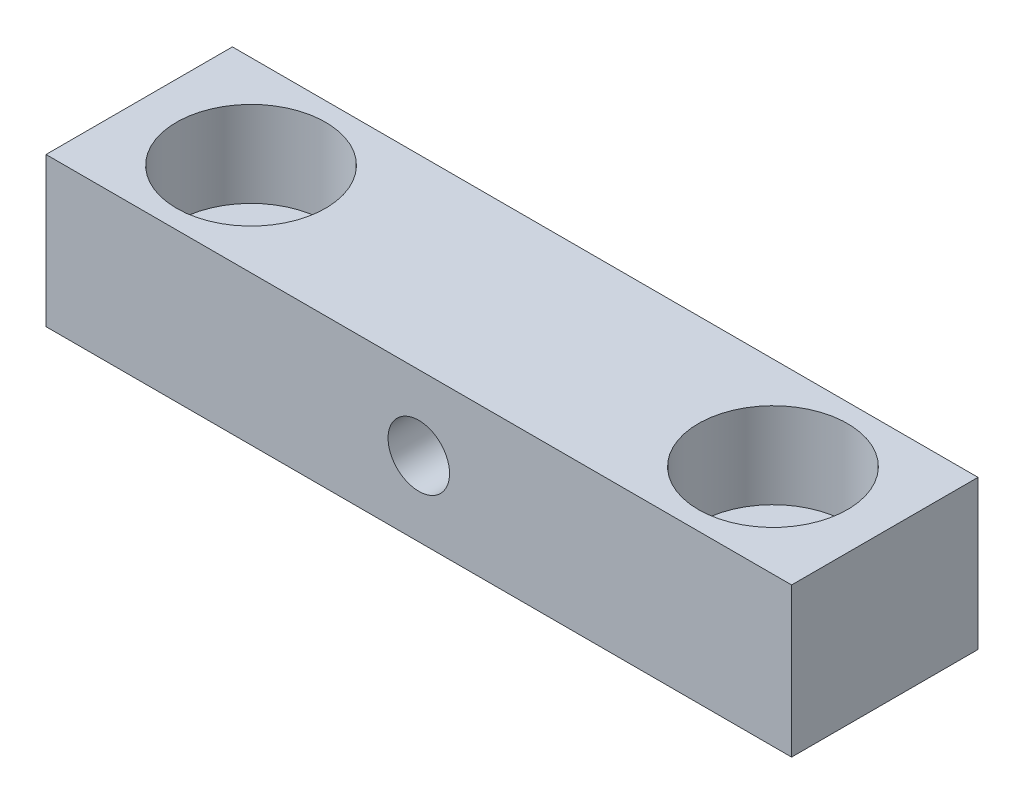
from build123d import *

# Parameters (mm, degrees)
SKETCH_1_W                = 40
SKETCH_1_H                = 10
EXTRUDE_1_DEPTH           = 8
HOLE_WIZARD_1_D           = 4.5
HOLE_WIZARD_1_CBORE_D     = 8
HOLE_WIZARD_1_CBORE_DEPTH = 4.6
HOLE_WIZARD_M4_1_D        = 3.3


with BuildPart() as part:
    # 草图1 → 凸台-拉伸1 (new body)
    with BuildSketch(Plane(origin=(0, 0, 0), x_dir=(1, 0, 0), z_dir=(0, 1, 0))):
        Rectangle(SKETCH_1_W, SKETCH_1_H)
    extrude(amount=EXTRUDE_1_DEPTH)

    # 打孔尺寸(%根据)内六角圆柱头螺钉的类型1 (through all)
    with Locations(Plane(origin=(0, 8, 0), x_dir=(1, 0, 0), z_dir=(0, 1, 0))):
        with Locations((14, 0), (-14, 0)):
            CounterBoreHole(HOLE_WIZARD_1_D / 2, HOLE_WIZARD_1_CBORE_D / 2, HOLE_WIZARD_1_CBORE_DEPTH)

    # M4 螺纹孔1 (through all)
    with Locations(Plane.XY.offset(5)):
        with Locations((0, 4)):
            Hole(HOLE_WIZARD_M4_1_D / 2)


solid = part.part
